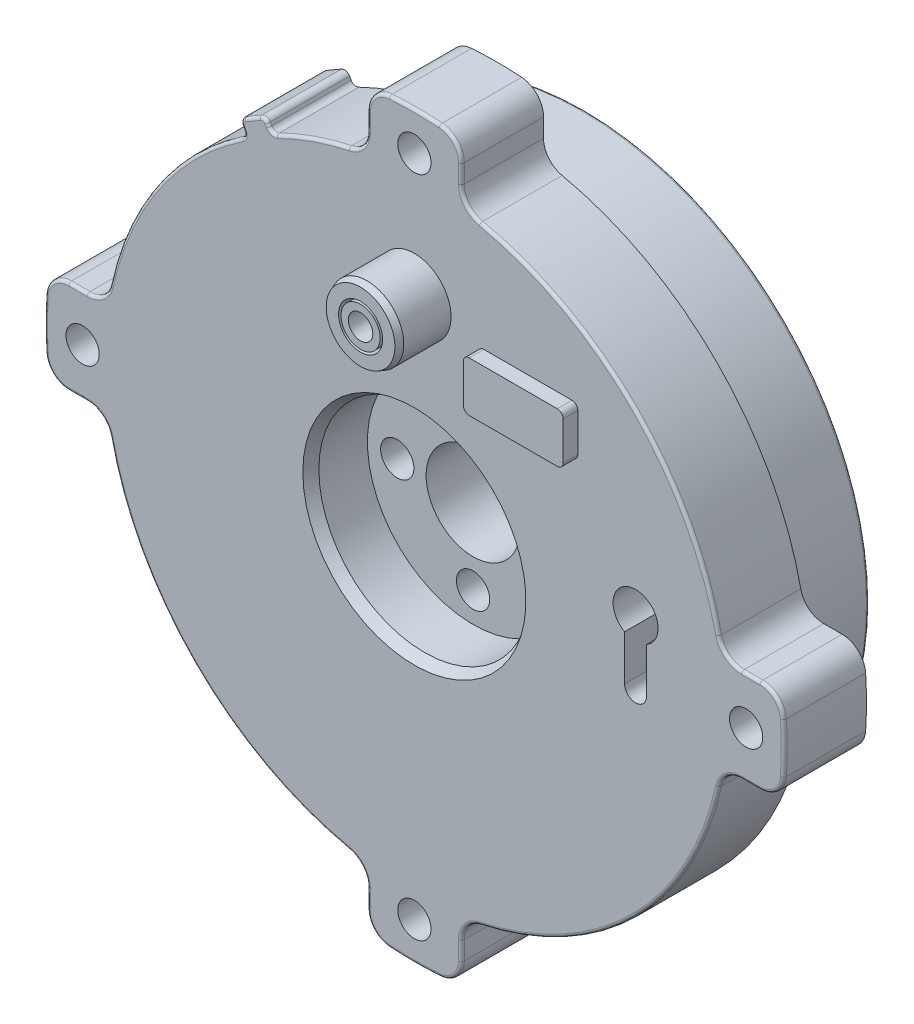
from build123d import *

# Parameters (mm, degrees)
SKETCH_7_R                   = 9
CUT_EXTRUDE_1_DEPTH          = 5
CUT_EXTRUDE_4_REACH          = 45.972
SKETCH_4_R                   = 3.125
SKETCH_4_R_2                 = 1.875
SKETCH_4_R_3                 = 1.666666667
SKETCH_4_R_4                 = 1.041666667
EXTRUDE_2_DEPTH              = 4.583333333
EXTRUDE_START                = -9.583333333
SKETCH_4_7_R                 = 1.666666667
SKETCH_4_7_R_2               = 1.041666667
EXTRUDE_6_DEPTH              = 4.583333333
CUT_EXTRUDE_START            = -10
SKETCH_4_3_R                 = 1.041666667
CUT_EXTRUDE_3_DEPTH          = 10
EXTRUDE_3_DEPTH              = 7
EXTRUDE_4_DEPTH              = 7
FILLET_2_R                   = 0.5
HOLE_WIZARD_M3_1_D           = 2.833333333
HOLE_WIZARD_M3_1_CBORE_D     = 5
HOLE_WIZARD_M3_1_CBORE_DEPTH = 2.5
HOLE_WIZARD_M3_2_D           = 2.833333333
HOLE_WIZARD_M3_2_CBORE_D     = 5
HOLE_WIZARD_M3_2_CBORE_DEPTH = 2.5
PATTERN_CIRCULAR_2_COUNT     = 4
EXTRUDE_1_DEPTH              = 1.25
CHAMFER_1_SIZE               = 0.2
CHAMFER_1_SIZE2              = 0.549495484
CHAMFER_2_SIZE               = 0.5
CHAMFER_2_SIZE2              = 0.866025404
FILLET_5_R                   = 2
FILLET_4_R                   = 0.254


with BuildPart() as part:
    # 草图2 → 旋转1 (revolve)
    with BuildSketch(Plane(origin=(0, 0, 0), x_dir=(0, 0, -1), z_dir=(1, 0, 0)), mode=Mode.PRIVATE) as revolve_1_sk:
        Polygon((0, 26.5), (0, 4), (23, 4), (23, 10.416666667), (10, 10.416666667), (10, 15.416666667), (5, 15.416666667), (5, 22.25), (14.5, 22.25), (14.5, 24.25), (7, 24.25), (7, 26.5), align=None)
    revolve(revolve_1_sk.sketch.rotate(Axis((0, 0, 40.809162727), (0, 0, -1)), 90), axis=Axis((0, 0, 40.809162727), (0, 0, -1)))

    # 草图7 → 切除-拉伸1 (cut)
    with BuildSketch(Plane.XY):
        Circle(SKETCH_7_R)
    extrude(amount=-CUT_EXTRUDE_1_DEPTH, mode=Mode.SUBTRACT)

    # 草图11 → 切除-拉伸4 (cut, up to next)
    with BuildSketch(Plane.XY, mode=Mode.PRIVATE) as cut_extrude_4_sk1:
        with BuildLine():
            Line((19.770833333, 1.916666667), (19.770833333, -1.916666667))
            ThreePointArc((19.770833333, -1.916666667), (18.833333333, -2.854166667), (17.895833333, -1.916666667))
            Line((17.895833333, -1.916666667), (17.895833333, 1.916666667))
            ThreePointArc((17.895833333, 1.916666667), (18.833333333, 5.505070412), (19.770833333, 1.916666667))
        make_face()
    cut_extrude_4_tool1 = extrude(cut_extrude_4_sk1.sketch, amount=-CUT_EXTRUDE_4_REACH, mode=Mode.PRIVATE) & part.part
    add(cut_extrude_4_tool1.solids().sort_by_distance((18.833333, 1.901842, 0))[0], mode=Mode.SUBTRACT)

    # 草图4 → 凸台-拉伸2 (add)
    # profile 1 of 6: a face of its own
    with BuildSketch(Plane.XY):
        with Locations(Location((0, 17.75, 0), (0, 0, 180))):
            Circle(SKETCH_4_R)
        with Locations((0, 17.75)):
            Circle(SKETCH_4_R_2, mode=Mode.SUBTRACT)
    # profile 2 of 6: a face of its own
    with BuildSketch(Plane.XY):
        with Locations(Location((0, 17.75, 0), (0, 0, 180))):
            Circle(SKETCH_4_R_3)
        with Locations((0, 17.75)):
            Circle(SKETCH_4_R_4, mode=Mode.SUBTRACT)
    # profile 3 of 6: a face of its own
    with BuildSketch(Plane.XY):
        with BuildLine():
            ThreePointArc((3.125, 17.75), (2.209708691, 19.959708691), (0, 20.875))
            Line((0, 20.875), (0, 19.625))
            ThreePointArc((0, 19.625), (1.325825215, 19.075825215), (1.875, 17.75))
            ThreePointArc((1.875, 17.75), (1.325825215, 16.424174785), (0, 15.875))
            Line((0, 15.875), (0, 14.625))
            ThreePointArc((0, 14.625), (2.209708691, 15.540291309), (3.125, 17.75))
        make_face()
    # profile 4 of 6: a face of its own
    with BuildSketch(Plane.XY):
        with BuildLine():
            Line((0, 19.625), (0, 20.875))
            ThreePointArc((0, 20.875), (-3.125, 17.75), (0, 14.625))
            Line((0, 14.625), (0, 15.875))
            ThreePointArc((0, 15.875), (-1.875, 17.75), (0, 19.625))
        make_face()
    # profile 5 of 6: a face of its own
    with BuildSketch(Plane.XY):
        with BuildLine():
            ThreePointArc((1.666666667, 17.75), (1.178511302, 18.928511302), (0, 19.416666667))
            Line((0, 19.416666667), (0, 18.791666667))
            ThreePointArc((0, 18.791666667), (0.736569564, 18.486569564), (1.041666667, 17.75))
            ThreePointArc((1.041666667, 17.75), (0.736569564, 17.013430436), (0, 16.708333333))
            Line((0, 16.708333333), (0, 16.083333333))
            ThreePointArc((0, 16.083333333), (1.178511302, 16.571488698), (1.666666667, 17.75))
        make_face()
    # profile 6 of 6: a face of its own
    with BuildSketch(Plane.XY):
        with BuildLine():
            Line((0, 18.791666667), (0, 19.416666667))
            ThreePointArc((0, 19.416666667), (-1.666666667, 17.75), (0, 16.083333333))
            Line((0, 16.083333333), (0, 16.708333333))
            ThreePointArc((0, 16.708333333), (-1.041666667, 17.75), (0, 18.791666667))
        make_face()
    extrude(amount=EXTRUDE_2_DEPTH)

    # 草图4<7> → 凸台-拉伸6 (add)
    with BuildSketch(Plane.XY.offset(EXTRUDE_START)):
        with Locations(Location((0, 17.75, 0), (0, 0, 180))):
            Circle(SKETCH_4_7_R)
        with Locations((0, 17.75)):
            Circle(SKETCH_4_7_R_2, mode=Mode.SUBTRACT)
    extrude(amount=EXTRUDE_6_DEPTH)

    # 草图4<3> → 切除-拉伸3 (cut)
    with BuildSketch(Plane.XY.offset(CUT_EXTRUDE_START)):
        with Locations((0, 17.75)):
            Circle(SKETCH_4_3_R)
    extrude(amount=CUT_EXTRUDE_3_DEPTH, mode=Mode.SUBTRACT)

    # 草图9 → 凸台-拉伸3 (add)
    with BuildSketch(Plane.XY):
        with BuildLine():
            Line((4, 29.432125306), (4, 26.196373795))
            ThreePointArc((4, 26.196373795), (0, 26.5), (-4, 26.196373795))
            Line((-4, 26.196373795), (-4, 29.432125306))
            ThreePointArc((-4, 29.432125306), (-3.461366901, 30.797558123), (-2.13559322, 31.427523631))
            ThreePointArc((-2.13559322, 31.427523631), (0, 31.5), (2.13559322, 31.427523631))
            ThreePointArc((2.13559322, 31.427523631), (3.461366901, 30.797558123), (4, 29.432125306))
        make_face()
        with BuildLine():
            Line((29.432125306, -4), (26.196373795, -4))
            ThreePointArc((26.196373795, -4), (26.5, 0), (26.196373795, 4))
            Line((26.196373795, 4), (29.432125306, 4))
            ThreePointArc((29.432125306, 4), (30.797558123, 3.461366901), (31.427523631, 2.13559322))
            ThreePointArc((31.427523631, 2.13559322), (31.5, 0), (31.427523631, -2.13559322))
            ThreePointArc((31.427523631, -2.13559322), (30.797558123, -3.461366901), (29.432125306, -4))
        make_face()
        with BuildLine():
            Line((-4, -29.432125306), (-4, -26.196373795))
            ThreePointArc((-4, -26.196373795), (0, -26.5), (4, -26.196373795))
            Line((4, -26.196373795), (4, -29.432125306))
            ThreePointArc((4, -29.432125306), (3.461366901, -30.797558123), (2.13559322, -31.427523631))
            ThreePointArc((2.13559322, -31.427523631), (0, -31.5), (-2.13559322, -31.427523631))
            ThreePointArc((-2.13559322, -31.427523631), (-3.461366901, -30.797558123), (-4, -29.432125306))
        make_face()
        with BuildLine():
            Line((-29.432125306, 4), (-26.196373795, 4))
            ThreePointArc((-26.196373795, 4), (-26.5, 0), (-26.196373795, -4))
            Line((-26.196373795, -4), (-29.432125306, -4))
            ThreePointArc((-29.432125306, -4), (-30.797558123, -3.461366901), (-31.427523631, -2.13559322))
            ThreePointArc((-31.427523631, -2.13559322), (-31.5, 0), (-31.427523631, 2.13559322))
            ThreePointArc((-31.427523631, 2.13559322), (-30.797558123, 3.461366901), (-29.432125306, 4))
        make_face()
    extrude(amount=-EXTRUDE_3_DEPTH)

    # 草图10 → 凸台-拉伸4 (add)
    with BuildSketch(Plane.XY):
        with BuildLine():
            Line((-13.200480947, 24.363903685), (-14.499519053, 23.613903685))
            ThreePointArc((-14.499519053, 23.613903685), (-14.732481966, 23.310300505), (-14.682531755, 22.930890983))
            Line((-14.682531755, 22.930890983), (-14.31778298, 22.299127573))
            ThreePointArc((-14.31778298, 22.299127573), (-13.25, 22.9496732), (-12.152719471, 23.549127573))
            Line((-12.152719471, 23.549127573), (-12.517468245, 24.180890983))
            ThreePointArc((-12.517468245, 24.180890983), (-12.821071425, 24.413853896), (-13.200480947, 24.363903685))
        make_face()
    extrude(amount=-EXTRUDE_4_DEPTH)

    # 圆角2
    fillet_2_edges = [part.edges().sort_by_distance(p)[0] for p in [
        (-12.152719471, 23.549127573, -3.5),
        (-14.31778298, 22.299127573, -3.5),
    ]]
    fillet(fillet_2_edges, radius=FILLET_2_R)

    # M3 六角头螺钉的柱形沉头孔1 (through all)
    with Locations(Plane(origin=(0, 0, -7), x_dir=(-1, 0, 0), z_dir=(0, 0, -1))):
        with Locations((0, 28.25), (28.25, 0), (-28.25, 0), (0, -28.25)):
            CounterBoreHole(HOLE_WIZARD_M3_1_D / 2, HOLE_WIZARD_M3_1_CBORE_D / 2, HOLE_WIZARD_M3_1_CBORE_DEPTH)

    # M3 六角头螺钉的柱形沉头孔2 (through all)
    with Locations(Plane.XY):
        with Locations((0, 6.458333333)):
            hole_wizard_m3_2 = CounterBoreHole(HOLE_WIZARD_M3_2_D / 2, HOLE_WIZARD_M3_2_CBORE_D / 2, HOLE_WIZARD_M3_2_CBORE_DEPTH)

    # 阵列(圆周)2: M3 六角头螺钉的柱形沉头孔2 ×4 about axis
    pattern_circular_2_axis = Axis((0, 0, 0), (0, 0, 1))
    for i in range(1, PATTERN_CIRCULAR_2_COUNT):
        add(hole_wizard_m3_2.rotate(pattern_circular_2_axis, i * 360 / PATTERN_CIRCULAR_2_COUNT), mode=Mode.SUBTRACT)

    # 草图3 → 凸台-拉伸1 (add)
    with BuildSketch(Plane.XY):
        with BuildLine():
            Line((5.916666667, 16.75), (13.416666667, 16.75))
            ThreePointArc((13.416666667, 16.75), (13.770220057, 16.603553391), (13.916666667, 16.25))
            Line((13.916666667, 16.25), (13.916666667, 13))
            ThreePointArc((13.916666667, 13), (13.770220057, 12.646446609), (13.416666667, 12.5))
            Line((13.416666667, 12.5), (5.916666667, 12.5))
            ThreePointArc((5.916666667, 12.5), (5.563113276, 12.646446609), (5.416666667, 13))
            Line((5.416666667, 13), (5.416666667, 16.25))
            ThreePointArc((5.416666667, 16.25), (5.563113276, 16.603553391), (5.916666667, 16.75))
        make_face()
    extrude(amount=EXTRUDE_1_DEPTH)

    # 倒角1
    chamfer_1_edges = [part.edges().sort_by_distance(p)[0] for p in [
        (3.125, 17.75, 4.583333333),
    ]]
    chamfer_1_side = [part.faces().sort_by_distance(p)[0] for p in [
        (3.036611652, 17.75, 4.583333333),
    ]]
    chamfer(chamfer_1_edges, length=CHAMFER_1_SIZE, length2=CHAMFER_1_SIZE2, reference=chamfer_1_side[0])

    # 倒角2
    chamfer_2_edges = [part.edges().sort_by_distance(p)[0] for p in [
        (-9, 0, 0),
    ]]
    chamfer_2_side = [part.faces().sort_by_distance(p)[0] for p in [
        (-21.602605772, 13.753204464, 0),
    ]]
    chamfer(chamfer_2_edges, length=CHAMFER_2_SIZE, length2=CHAMFER_2_SIZE2, reference=chamfer_2_side[0])

    # 圆角5
    fillet_5_edges = [part.edges().sort_by_distance(p)[0] for p in [
        (-4, -26.196373795, -3.5),
        (4, -26.196373795, -3.5),
        (-26.196373795, 4, -3.5),
        (-26.196373795, -4, -3.5),
        (4, 26.196373795, -3.5),
        (-4, 26.196373795, -3.5),
        (26.196373795, -4, -3.5),
        (26.196373795, 4, -3.5),
    ]]
    fillet(fillet_5_edges, radius=FILLET_5_R)

    # 圆角4
    fillet_4_edges = [part.edges().sort_by_distance(p)[0] for p in [
        (-3.461366901, -30.797558123, 0),
        (0, -31.5, 0),
        (3.461366901, -30.797558123, 0),
        (4, -28.646694369, 0),
        (-15.416666667, 0, -10),
        (-10.416666667, 0, -23),
        (-30.797558123, 3.461366901, 0),
        (-31.5, 0, 0),
        (-30.797558123, -3.461366901, 0),
        (-28.646694369, -4, 0),
        (-12.821071425, 24.413853896, 0),
        (-13.85, 23.988903685, 0),
        (-14.732481966, 23.310300505, 0),
        (-14.618338592, 22.819705164, 0),
        (-12.453275083, 24.069705164, 0),
        (-21.912827604, 14.902281249, 0),
        (-12.101070506, 23.730006412, 0),
        (-14.500253132, 22.344837677, 0),
        (-8.723041213, 25.023160312, 0),
        (18.738329701, 18.738329701, 0),
        (4, 28.646694369, 0),
        (18.738329701, -18.738329701, 0),
        (28.646694369, -4, 0),
        (-18.738329701, -18.738329701, 0),
        (-4, -28.646694369, 0),
        (-28.646694369, 4, 0),
        (-4.44402679, 26.604701707, 0),
        (4.44402679, 26.604701707, 0),
        (26.604701707, 4.44402679, 0),
        (26.604701707, -4.44402679, 0),
        (4.44402679, -26.604701707, 0),
        (-4.44402679, -26.604701707, 0),
        (-26.604701707, -4.44402679, 0),
        (-26.604701707, 4.44402679, 0),
        (3.461366901, 30.797558123, 0),
        (0, 31.5, 0),
        (-3.461366901, 30.797558123, 0),
        (-4, 28.646694369, 0),
        (-24.25, 0, -14.5),
        (30.797558123, -3.461366901, 0),
        (31.5, 0, 0),
        (30.797558123, 3.461366901, 0),
        (28.646694369, 4, 0),
        (-22.25, 0, -14.5),
    ]]
    fillet(fillet_4_edges, radius=FILLET_4_R)


solid = part.part
